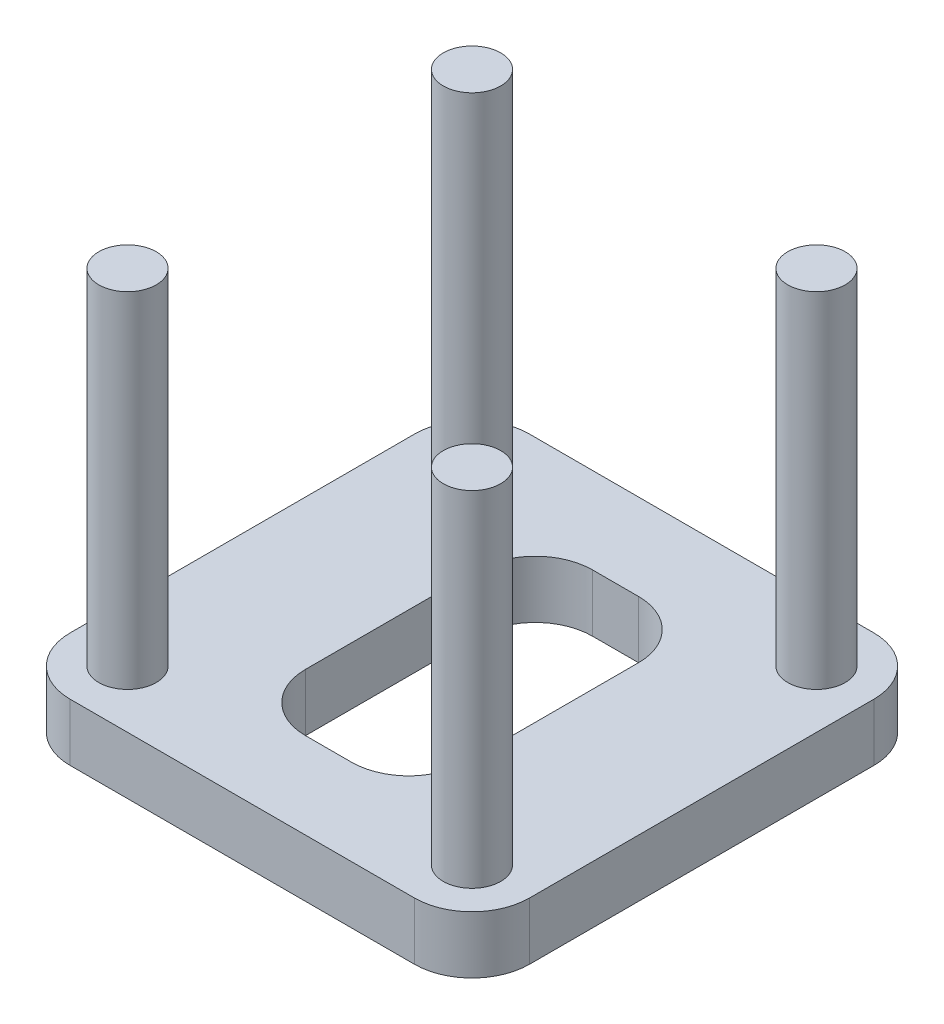
from build123d import *

# Parameters (mm, degrees)
SKETCH_1_W          = 80
SKETCH_1_H          = 80
EXTRUDE_1_DEPTH     = 10
FILLET_1_R          = 10
SKETCH_2_W          = 10
SKETCH_2_H          = 10
CUT_EXTRUDE_1_DEPTH = 8
CUT_EXTRUDE_2_DEPTH = 58.445626465
SKETCH_4_R          = 5
EXTRUDE_2_DEPTH     = 60


with BuildPart() as part:
    # ｽｹｯﾁ1 → ﾎﾞｽ - 押し出し1 (new body)
    with BuildSketch(Plane(origin=(0, 0, 0), x_dir=(1, 0, 0), z_dir=(0, 1, 0))):
        Rectangle(SKETCH_1_W, SKETCH_1_H)
    extrude(amount=EXTRUDE_1_DEPTH)

    # ﾌｨﾚｯﾄ1
    fillet_1_edges = [part.edges().sort_by_distance(p)[0] for p in [
        (40, 5, 40),
        (-40, 5, 40),
        (-40, 5, -40),
        (40, 5, -40),
    ]]
    fillet(fillet_1_edges, radius=FILLET_1_R)

    # ｽｹｯﾁ2 → ｶｯﾄ - 押し出し1 (cut)
    with BuildSketch(Plane(origin=(0, 0, 0), x_dir=(1, 0, 0), z_dir=(0, 1, 0))):
        with Locations((-27, 0)):
            Rectangle(SKETCH_2_W, SKETCH_2_H)
        with Locations((27, 0)):
            Rectangle(SKETCH_2_W, SKETCH_2_H)
    extrude(amount=CUT_EXTRUDE_1_DEPTH, mode=Mode.SUBTRACT)

    # ｽｹｯﾁ3 → ｶｯﾄ - 押し出し2 (cut, through all)
    with BuildSketch(Plane(origin=(0, 10, 0), x_dir=(1, 0, 0), z_dir=(0, 1, 0))):
        with BuildLine():
            Line((-4, -25), (4, -25))
            ThreePointArc((4, -25), (11.071067812, -22.071067812), (14, -15))
            Line((14, -15), (14, 15))
            ThreePointArc((14, 15), (11.071067812, 22.071067812), (4, 25))
            Line((4, 25), (-4, 25))
            ThreePointArc((-4, 25), (-11.071067812, 22.071067812), (-14, 15))
            Line((-14, 15), (-14, -15))
            ThreePointArc((-14, -15), (-11.071067812, -22.071067812), (-4, -25))
        make_face()
    extrude(amount=-CUT_EXTRUDE_2_DEPTH, mode=Mode.SUBTRACT)

    # ｽｹｯﾁ4 → ﾎﾞｽ - 押し出し2 (add)
    with BuildSketch(Plane(origin=(0, 10, 0), x_dir=(1, 0, 0), z_dir=(0, 1, 0))):
        with Locations(Location((-30, 30, 0), (0, 0, 90))):
            Circle(SKETCH_4_R)
        with Locations(Location((30, 30, 0), (0, 0, 90))):
            Circle(SKETCH_4_R)
        with Locations(Location((-30, -30, 0), (0, 0, 90))):
            Circle(SKETCH_4_R)
        with Locations(Location((30, -30, 0), (0, 0, 90))):
            Circle(SKETCH_4_R)
    extrude(amount=EXTRUDE_2_DEPTH)


solid = part.part
